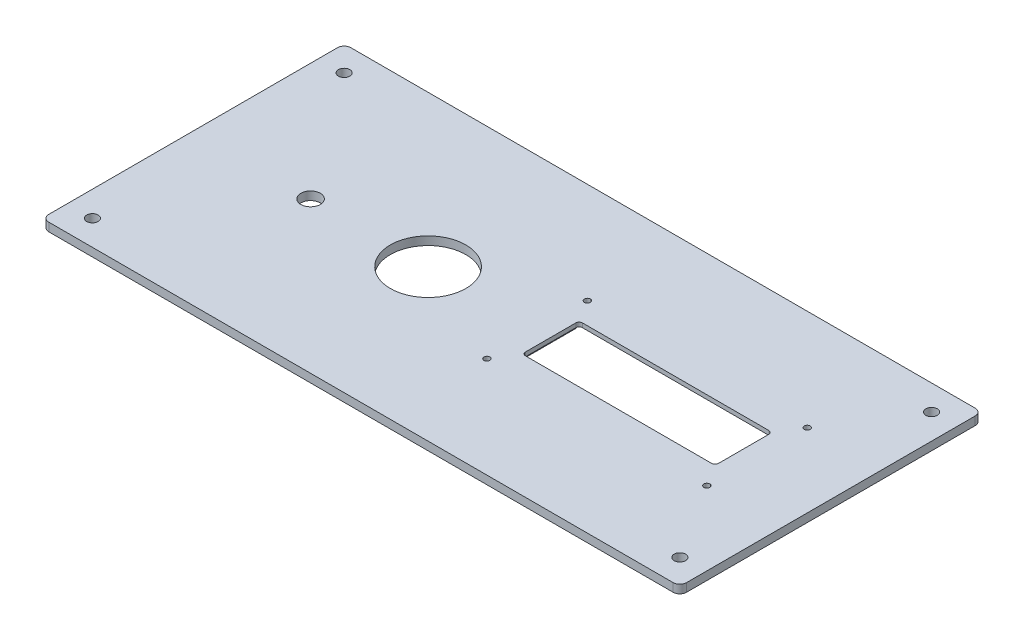
from build123d import *

# Parameters (mm, degrees)
SKETCH1_W           = 241.3
SKETCH1_H           = 114.3
SKETCH1_R           = 2.159
SKETCH1_R_2         = 3.683
SKETCH1_R_3         = 14.2875
SKETCH1_R_4         = 1.1303
SKETCH1_W_2         = 73.025
SKETCH1_H_2         = 21.59
BOSS_EXTRUDE1_DEPTH = 3.175
FILLET1_R           = 1.27
FILLET2_R           = 2.54
CUT_EXTRUDE1_START  = -1.5875
SKETCH2_R           = 1.5875
SKETCH2_W           = 75.692
SKETCH2_H           = 25.146
CUT_EXTRUDE1_DEPTH  = 1.5875


with BuildPart() as part:
    # Sketch1 → Boss-Extrude1 (new body)
    with BuildSketch(Plane(origin=(0, 0, 0), x_dir=(1, 0, 0), z_dir=(0, 1, 0))):
        Rectangle(SKETCH1_W, SKETCH1_H)
        with Locations(Location((-111.125, 47.625, 0), (0, 0, 270))):
            Circle(SKETCH1_R, mode=Mode.SUBTRACT)
        with Locations(Location((111.125, 47.625, 0), (0, 0, 90))):
            Circle(SKETCH1_R, mode=Mode.SUBTRACT)
        with Locations(Location((111.125, -47.625, 0), (0, 0, 270))):
            Circle(SKETCH1_R, mode=Mode.SUBTRACT)
        with Locations(Location((-111.125, -47.625, 0), (0, 0, 90))):
            Circle(SKETCH1_R, mode=Mode.SUBTRACT)
        with Locations(Location((-76.2, 0, 0), (0, 0, 270))):
            Circle(SKETCH1_R_2, mode=Mode.SUBTRACT)
        with Locations(Location((-31.75, 0, 0), (0, 0, 270))):
            Circle(SKETCH1_R_3, mode=Mode.SUBTRACT)
        with Locations(Location((9.5175, 19, 0), (0, 0, 270))):
            Circle(SKETCH1_R_4, mode=Mode.SUBTRACT)
        with Locations(Location((9.5175, -19, 0), (0, 0, 90))):
            Circle(SKETCH1_R_4, mode=Mode.SUBTRACT)
        with Locations(Location((92.7175, -19, 0), (0, 0, 270))):
            Circle(SKETCH1_R_4, mode=Mode.SUBTRACT)
        with Locations(Location((92.7175, 19, 0), (0, 0, 90))):
            Circle(SKETCH1_R_4, mode=Mode.SUBTRACT)
        with Locations((51.1175, 0)):
            Rectangle(SKETCH1_W_2, SKETCH1_H_2, mode=Mode.SUBTRACT)
    extrude(amount=BOSS_EXTRUDE1_DEPTH)

    # Fillet1
    fillet1_edges = [part.edges().sort_by_distance(p)[0] for p in [
        (87.63, 1.5875, 10.795),
        (87.63, 1.5875, -10.795),
        (14.605, 1.5875, -10.795),
        (14.605, 1.5875, 10.795),
    ]]
    fillet(fillet1_edges, radius=FILLET1_R)

    # Fillet2
    fillet2_edges = [part.edges().sort_by_distance(p)[0] for p in [
        (120.65, 1.5875, 57.15),
        (-120.65, 1.5875, 57.15),
        (-120.65, 1.5875, -57.15),
        (120.65, 1.5875, -57.15),
    ]]
    fillet(fillet2_edges, radius=FILLET2_R)

    # Sketch2 → Cut-Extrude1 (cut)
    # profile 1 of 21: a face of its own
    with BuildSketch(Plane(origin=(0, 0, 0), x_dir=(-1, 0, 0), z_dir=(0, -1, 0)).offset(CUT_EXTRUDE1_START)):
        with Locations((-13.2715, 12.573)):
            Circle(SKETCH2_R)
    # profile 2 of 21: a face of its own
    with BuildSketch(Plane(origin=(0, 0, 0), x_dir=(-1, 0, 0), z_dir=(0, -1, 0)).offset(CUT_EXTRUDE1_START)):
        with Locations((-88.9635, 12.573)):
            Circle(SKETCH2_R)
    # profile 3 of 21: a face of its own
    with BuildSketch(Plane(origin=(0, 0, 0), x_dir=(-1, 0, 0), z_dir=(0, -1, 0)).offset(CUT_EXTRUDE1_START)):
        with Locations((-88.9635, -12.573)):
            Circle(SKETCH2_R)
    # profile 4 of 21: a face of its own
    with BuildSketch(Plane(origin=(0, 0, 0), x_dir=(-1, 0, 0), z_dir=(0, -1, 0)).offset(CUT_EXTRUDE1_START)):
        with Locations((-13.2715, -12.573)):
            Circle(SKETCH2_R)
    # profile 5 of 21: a face of its own
    with BuildSketch(Plane(origin=(0, 0, 0), x_dir=(-1, 0, 0), z_dir=(0, -1, 0)).offset(CUT_EXTRUDE1_START)):
        with Locations((-51.1175, 0)):
            Rectangle(SKETCH2_W, SKETCH2_H)
        with BuildLine():
            ThreePointArc((-15.875, 10.795), (-14.976974388, 10.423025612), (-14.605, 9.525))
            Line((-14.605, 9.525), (-14.605, -9.525))
            ThreePointArc((-14.605, -9.525), (-14.976974388, -10.423025612), (-15.875, -10.795))
            Line((-15.875, -10.795), (-86.36, -10.795))
            ThreePointArc((-86.36, -10.795), (-87.258025612, -10.423025612), (-87.63, -9.525))
            Line((-87.63, -9.525), (-87.63, 9.525))
            ThreePointArc((-87.63, 9.525), (-87.258025612, 10.423025612), (-86.36, 10.795))
            Line((-86.36, 10.795), (-15.875, 10.795))
        make_face(mode=Mode.SUBTRACT)
    # profile 6 of 21: a face of its own
    with BuildSketch(Plane(origin=(0, 0, 0), x_dir=(-1, 0, 0), z_dir=(0, -1, 0)).offset(CUT_EXTRUDE1_START)):
        with BuildLine():
            Line((-88.9635, -10.9855), (-88.9635, -12.573))
            Line((-88.9635, -12.573), (-87.376, -12.573))
            ThreePointArc((-87.376, -12.573), (-87.840967985, -11.450467985), (-88.9635, -10.9855))
        make_face()
    # profile 7 of 21: a face of its own
    with BuildSketch(Plane(origin=(0, 0, 0), x_dir=(-1, 0, 0), z_dir=(0, -1, 0)).offset(CUT_EXTRUDE1_START)):
        with BuildLine():
            Line((-87.376, -12.573), (-88.9635, -12.573))
            Line((-88.9635, -12.573), (-88.9635, -10.9855))
            ThreePointArc((-88.9635, -10.9855), (-90.086032015, -13.695532015), (-87.376, -12.573))
        make_face()
    # profile 8 of 21: a face of its own
    with BuildSketch(Plane(origin=(0, 0, 0), x_dir=(-1, 0, 0), z_dir=(0, -1, 0)).offset(CUT_EXTRUDE1_START)):
        with BuildLine():
            Line((-88.9635, -10.9855), (-88.9635, -12.573))
            Line((-88.9635, -12.573), (-87.376, -12.573))
            ThreePointArc((-87.376, -12.573), (-87.840967985, -11.450467985), (-88.9635, -10.9855))
        make_face()
    # profile 9 of 21: a face of its own
    with BuildSketch(Plane(origin=(0, 0, 0), x_dir=(-1, 0, 0), z_dir=(0, -1, 0)).offset(CUT_EXTRUDE1_START)):
        with BuildLine():
            Line((-87.376, -12.573), (-88.9635, -12.573))
            Line((-88.9635, -12.573), (-88.9635, -10.9855))
            ThreePointArc((-88.9635, -10.9855), (-90.086032015, -13.695532015), (-87.376, -12.573))
        make_face()
    # profile 10 of 21: a face of its own
    with BuildSketch(Plane(origin=(0, 0, 0), x_dir=(-1, 0, 0), z_dir=(0, -1, 0)).offset(CUT_EXTRUDE1_START)):
        with BuildLine():
            ThreePointArc((-87.376, 12.573), (-90.086032015, 13.695532015), (-88.9635, 10.9855))
            Line((-88.9635, 10.9855), (-88.9635, 12.573))
            Line((-88.9635, 12.573), (-87.376, 12.573))
        make_face()
    # profile 11 of 21: a face of its own
    with BuildSketch(Plane(origin=(0, 0, 0), x_dir=(-1, 0, 0), z_dir=(0, -1, 0)).offset(CUT_EXTRUDE1_START)):
        with BuildLine():
            Line((-88.9635, 12.573), (-88.9635, 10.9855))
            ThreePointArc((-88.9635, 10.9855), (-87.840967985, 11.450467985), (-87.376, 12.573))
            Line((-87.376, 12.573), (-88.9635, 12.573))
        make_face()
    # profile 12 of 21: a face of its own
    with BuildSketch(Plane(origin=(0, 0, 0), x_dir=(-1, 0, 0), z_dir=(0, -1, 0)).offset(CUT_EXTRUDE1_START)):
        with BuildLine():
            ThreePointArc((-87.376, 12.573), (-90.086032015, 13.695532015), (-88.9635, 10.9855))
            Line((-88.9635, 10.9855), (-88.9635, 12.573))
            Line((-88.9635, 12.573), (-87.376, 12.573))
        make_face()
    # profile 13 of 21: a face of its own
    with BuildSketch(Plane(origin=(0, 0, 0), x_dir=(-1, 0, 0), z_dir=(0, -1, 0)).offset(CUT_EXTRUDE1_START)):
        with BuildLine():
            Line((-88.9635, 12.573), (-88.9635, 10.9855))
            ThreePointArc((-88.9635, 10.9855), (-87.840967985, 11.450467985), (-87.376, 12.573))
            Line((-87.376, 12.573), (-88.9635, 12.573))
        make_face()
    # profile 14 of 21: a face of its own
    with BuildSketch(Plane(origin=(0, 0, 0), x_dir=(-1, 0, 0), z_dir=(0, -1, 0)).offset(CUT_EXTRUDE1_START)):
        with BuildLine():
            ThreePointArc((-14.859, 12.573), (-14.394032015, 11.450467985), (-13.2715, 10.9855))
            Line((-13.2715, 10.9855), (-13.2715, 12.573))
            Line((-13.2715, 12.573), (-14.859, 12.573))
        make_face()
    # profile 15 of 21: a face of its own
    with BuildSketch(Plane(origin=(0, 0, 0), x_dir=(-1, 0, 0), z_dir=(0, -1, 0)).offset(CUT_EXTRUDE1_START)):
        with BuildLine():
            Line((-13.2715, 12.573), (-13.2715, 10.9855))
            ThreePointArc((-13.2715, 10.9855), (-12.148967985, 11.450467985), (-11.684, 12.573))
            ThreePointArc((-11.684, 12.573), (-13.2715, 14.1605), (-14.859, 12.573))
            Line((-14.859, 12.573), (-13.2715, 12.573))
        make_face()
    # profile 16 of 21: a face of its own
    with BuildSketch(Plane(origin=(0, 0, 0), x_dir=(-1, 0, 0), z_dir=(0, -1, 0)).offset(CUT_EXTRUDE1_START)):
        with BuildLine():
            ThreePointArc((-14.859, 12.573), (-14.394032015, 11.450467985), (-13.2715, 10.9855))
            Line((-13.2715, 10.9855), (-13.2715, 12.573))
            Line((-13.2715, 12.573), (-14.859, 12.573))
        make_face()
    # profile 17 of 21: a face of its own
    with BuildSketch(Plane(origin=(0, 0, 0), x_dir=(-1, 0, 0), z_dir=(0, -1, 0)).offset(CUT_EXTRUDE1_START)):
        with BuildLine():
            Line((-13.2715, 12.573), (-13.2715, 10.9855))
            ThreePointArc((-13.2715, 10.9855), (-12.148967985, 11.450467985), (-11.684, 12.573))
            ThreePointArc((-11.684, 12.573), (-13.2715, 14.1605), (-14.859, 12.573))
            Line((-14.859, 12.573), (-13.2715, 12.573))
        make_face()
    # profile 18 of 21: a face of its own
    with BuildSketch(Plane(origin=(0, 0, 0), x_dir=(-1, 0, 0), z_dir=(0, -1, 0)).offset(CUT_EXTRUDE1_START)):
        with BuildLine():
            ThreePointArc((-13.2715, -10.9855), (-14.394032015, -11.450467985), (-14.859, -12.573))
            Line((-14.859, -12.573), (-13.2715, -12.573))
            Line((-13.2715, -12.573), (-13.2715, -10.9855))
        make_face()
    # profile 19 of 21: a face of its own
    with BuildSketch(Plane(origin=(0, 0, 0), x_dir=(-1, 0, 0), z_dir=(0, -1, 0)).offset(CUT_EXTRUDE1_START)):
        with BuildLine():
            Line((-13.2715, -12.573), (-14.859, -12.573))
            ThreePointArc((-14.859, -12.573), (-13.2715, -14.1605), (-11.684, -12.573))
            ThreePointArc((-11.684, -12.573), (-12.148967985, -11.450467985), (-13.2715, -10.9855))
            Line((-13.2715, -10.9855), (-13.2715, -12.573))
        make_face()
    # profile 20 of 21: a face of its own
    with BuildSketch(Plane(origin=(0, 0, 0), x_dir=(-1, 0, 0), z_dir=(0, -1, 0)).offset(CUT_EXTRUDE1_START)):
        with BuildLine():
            ThreePointArc((-13.2715, -10.9855), (-14.394032015, -11.450467985), (-14.859, -12.573))
            Line((-14.859, -12.573), (-13.2715, -12.573))
            Line((-13.2715, -12.573), (-13.2715, -10.9855))
        make_face()
    # profile 21 of 21: a face of its own
    with BuildSketch(Plane(origin=(0, 0, 0), x_dir=(-1, 0, 0), z_dir=(0, -1, 0)).offset(CUT_EXTRUDE1_START)):
        with BuildLine():
            Line((-13.2715, -12.573), (-14.859, -12.573))
            ThreePointArc((-14.859, -12.573), (-13.2715, -14.1605), (-11.684, -12.573))
            ThreePointArc((-11.684, -12.573), (-12.148967985, -11.450467985), (-13.2715, -10.9855))
            Line((-13.2715, -10.9855), (-13.2715, -12.573))
        make_face()
    extrude(amount=CUT_EXTRUDE1_DEPTH, mode=Mode.SUBTRACT)


solid = part.part
